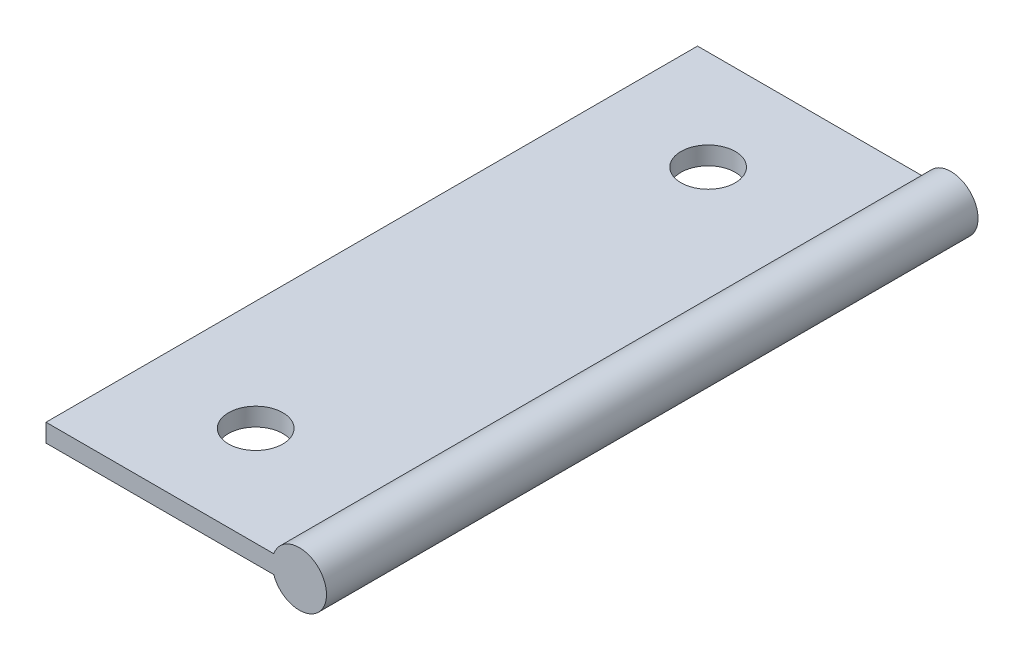
from build123d import *

# Parameters (mm, degrees)
EXTRUDE_1_DEPTH     = 36
SKETCH_2_R          = 1.5
CUT_EXTRUDE_1_DEPTH = 39.678159212


with BuildPart() as part:
    # 草图1 → 凸台-拉伸1 (new body)
    with BuildSketch(Plane.XY):
        with BuildLine():
            Line((-1.414213562, 0.5), (-14, 0.5))
            Line((-14, 0.5), (-14, -0.5))
            Line((-14, -0.5), (-1.414213562, -0.5))
            ThreePointArc((-1.414213562, -0.5), (1.5, 0), (-1.414213562, 0.5))
        make_face()
    extrude(amount=EXTRUDE_1_DEPTH)

    # 草图2 → 切除-拉伸1 (cut, through all)
    with BuildSketch(Plane(origin=(0, 0.5, 0), x_dir=(1, 0, 0), z_dir=(0, 1, 0))):
        with Locations(Location((-7.914213562, -5.5, 0), (0, 0, 180))):
            Circle(SKETCH_2_R)
        with Locations(Location((-7.914213562, -30.5, 0), (0, 0, 270))):
            Circle(SKETCH_2_R)
    extrude(amount=-CUT_EXTRUDE_1_DEPTH, mode=Mode.SUBTRACT)


solid = part.part
